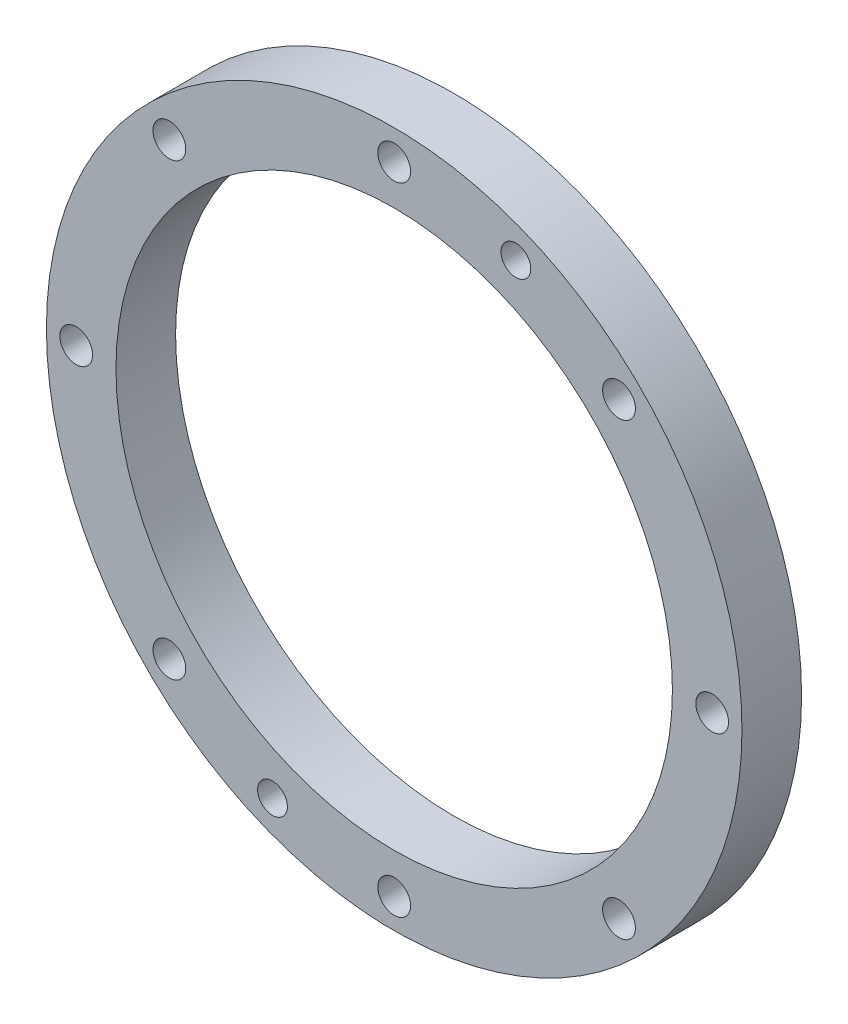
from build123d import *

# Parameters (mm, degrees)
SKETCH1_W                              = 14
SKETCH1_H                              = 12
SKETCH2_R                              = 3.3
SKETCH2_R_2                            = 3
CUT_8XTIE_D6_6_2XDOWEL_D6_PCD128_DEPTH = 150


with BuildPart() as part:
    # Sketch1 → REV_Interstage_Spacer (revolve)
    with BuildSketch(Plane(origin=(0, 0, 0), x_dir=(1, 0, 0), z_dir=(0, 1, 0))):
        with Locations((63, 13.5)):
            Rectangle(SKETCH1_W, SKETCH1_H)
    revolve(axis=Axis((0, 0, 150), (0, 0, -1)))

    # Sketch2 → CUT_8xTie_D6.6_2xDowel_D6_PCD128 (cut, symmetric)
    with BuildSketch(Plane.XY):
        with Locations(Location((64, 0, 0), (0, 0, 180))):
            Circle(SKETCH2_R)
        with Locations(Location((45.2548, 45.2548, 0), (0, 0, 180))):
            Circle(SKETCH2_R)
        with Locations(Location((0, 64, 0), (0, 0, 180))):
            Circle(SKETCH2_R)
        with Locations(Location((-45.2548, 45.2548, 0), (0, 0, 180))):
            Circle(SKETCH2_R)
        with Locations(Location((-64, 0, 0), (0, 0, 180))):
            Circle(SKETCH2_R)
        with Locations(Location((-45.2548, -45.2548, 0), (0, 0, 180))):
            Circle(SKETCH2_R)
        with Locations(Location((0, -64, 0), (0, 0, 180))):
            Circle(SKETCH2_R)
        with Locations(Location((45.2548, -45.2548, 0), (0, 0, 180))):
            Circle(SKETCH2_R)
        with Locations(Location((24.4917, 59.1283, 0), (0, 0, 180))):
            Circle(SKETCH2_R_2)
        with Locations(Location((-24.4917, -59.1283, 0), (0, 0, 180))):
            Circle(SKETCH2_R_2)
    extrude(amount=CUT_8XTIE_D6_6_2XDOWEL_D6_PCD128_DEPTH, both=True, mode=Mode.SUBTRACT)


solid = part.part
